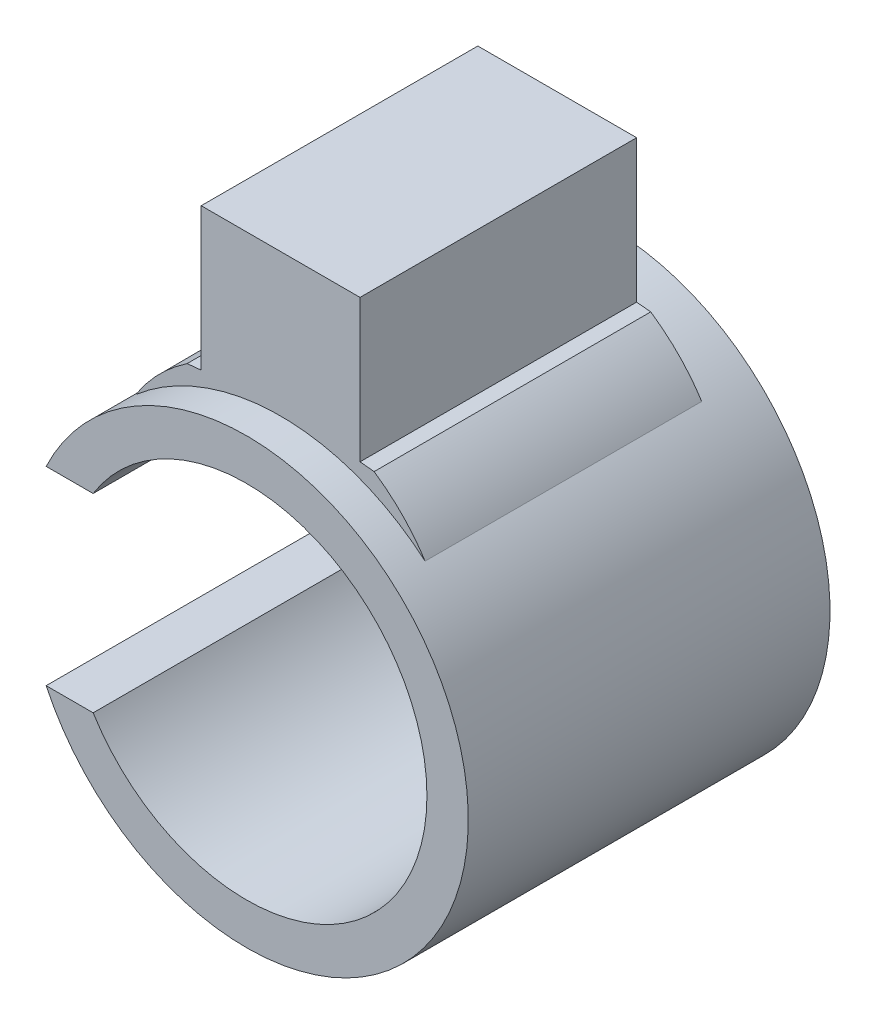
from build123d import *

# Parameters (mm, degrees)
SKETCH2_R           = 7.692100041
CUT_EXTRUDE1_DEPTH  = 10
SKETCH4_W           = 16.725751486
SKETCH4_H           = 29.132579912
BOSS_EXTRUDE1_DEPTH = 15
BOSS_EXTRUDE2_START = -29.132579912
BOSS_EXTRUDE2_DEPTH = 29.132579912
CUT_EXTRUDE2_DEPTH  = 72.857514692


with BuildPart() as part:
    # Sketch1 → Revolve1 (revolve)
    with BuildSketch(Plane(origin=(0, 0, 0), x_dir=(0, 0, -1), z_dir=(1, 0, 0)), mode=Mode.PRIVATE) as revolve1_sk:
        Polygon((18, 19), (53, 19), (53, 0), (56.096816333, 0), (56.096816333, 23.355709418), (18, 23.355709418), align=None)
    revolve(revolve1_sk.sketch.rotate(Axis((0, 0, -53), (0, 0, -1)), 90), axis=Axis((0, 0, -53), (0, 0, -1)))

    # Sketch2 → Cut-Extrude1 (cut)
    with BuildSketch(Plane(origin=(0, 0, -56.096816333), x_dir=(-1, 0, 0), z_dir=(0, 0, -1))):
        Circle(SKETCH2_R)
    extrude(amount=-CUT_EXTRUDE1_DEPTH, mode=Mode.SUBTRACT)



with BuildPart() as body_2:
    # Sketch4 → Boss-Extrude1 (new body)
    with BuildSketch(Plane(origin=(0, 23.355709418, 0), x_dir=(1, 0, 0), z_dir=(0, 1, 0))):
        with Locations((0, 36.155071486)):
            Rectangle(SKETCH4_W, SKETCH4_H)
    extrude(amount=BOSS_EXTRUDE1_DEPTH)


with BuildPart() as part_1:
    add(part.part)

    add(body_2.part)  # Boss-Extrude2 merges body 2
    # Sketch5 → Boss-Extrude2 (add)
    with BuildSketch(Plane(origin=(0, 0, -50.721361442), x_dir=(-1, 0, 0), z_dir=(0, 0, -1)).offset(BOSS_EXTRUDE2_START)):
        with BuildLine():
            ThreePointArc((-15.215762233, 17.71919135), (-8.113102925, 21.901295016), (0, 23.355709418))
            Line((0, 23.355709418), (-8.362875743, 23.355709418))
            Line((-8.362875743, 23.355709418), (-9.850694039, 23.211289977))
            add(Edge.make_bspline(
                [(-9.850694039, 23.211289977), (-13.176863257, 20.945911476), (-15.215762233, 17.71919135)],
                knots=[0, 0, 0, 0.793491279, 0.793491279, 0.793491279], degree=2))
        make_face()
        with BuildLine():
            add(Edge.make_bspline(
                [(9.850694039, 23.211289977), (13.176863257, 20.945911476), (15.215762233, 17.71919135)],
                knots=[0, 0, 0, 0.793491279, 0.793491279, 0.793491279], degree=2))
            Line((9.850694039, 23.211289977), (8.362875743, 23.355709418))
            Line((8.362875743, 23.355709418), (0, 23.355709418))
            ThreePointArc((0, 23.355709418), (8.113102925, 21.901295016), (15.215762233, 17.71919135))
        make_face()
    extrude(amount=BOSS_EXTRUDE2_DEPTH)

    # Sketch6 → Cut-Extrude2 (cut, through all)
    with BuildSketch(Plane.XY):
        with BuildLine():
            Line((-16.155494421, -10), (-21.106614187, -10))
            ThreePointArc((-21.106614187, -10), (-23.355709418, 0), (-21.106614187, 10))
            Line((-21.106614187, 10), (-16.155494421, 10))
            ThreePointArc((-16.155494421, 10), (-19, 0), (-16.155494421, -10))
        make_face()
    extrude(amount=-CUT_EXTRUDE2_DEPTH, mode=Mode.SUBTRACT)


solid = part_1.part
